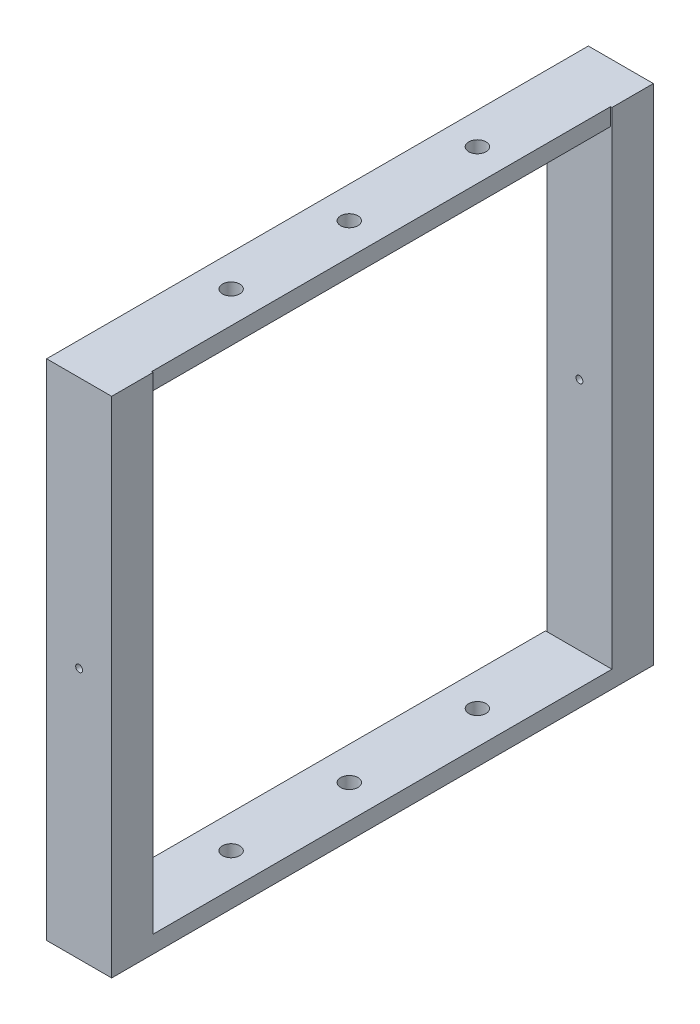
from build123d import *

# Parameters (mm, degrees)
SKETCH1_W            = 133
SKETCH1_H            = 133
BOSS_EXTRUDE2_DEPTH  = 136
SKETCH2_W            = 133
SKETCH2_H            = 118
CUT_EXTRUDE1_DEPTH   = 136
BOSS_EXTRUDE3_DEPTH  = 10.5
SKETCH5_W            = 21
SKETCH5_H            = 3
BOSS_EXTRUDE4_DEPTH  = 23.5
SKETCH6_W            = 42
SKETCH6_H            = 17.2
CUT_EXTRUDE2_DEPTH   = 3
BOSS_EXTRUDE5_DEPTH  = 10.5
SKETCH8_W            = 21
SKETCH8_H            = 3
BOSS_EXTRUDE6_DEPTH  = 23.5
SKETCH9_W            = 42
SKETCH9_H            = 17.2
CUT_EXTRUDE3_DEPTH   = 3
SKETCH10_W           = 19.261488562
SKETCH10_H           = 133
BOSS_EXTRUDE7_DEPTH  = 5
SKETCH11_W           = 18.43727499
SKETCH11_H           = 133
BOSS_EXTRUDE8_DEPTH  = 5
SKETCH12_W           = 18.849381776
SKETCH12_H           = 146
BOSS_EXTRUDE9_DEPTH  = 12
SKETCH14_W           = 18.849381776
SKETCH14_H           = 146
BOSS_EXTRUDE10_DEPTH = 12
SKETCH17_R           = 1
CUT_EXTRUDE4_DEPTH   = 222.251553667
SKETCH18_W           = 133
SKETCH18_H           = 136
CUT_EXTRUDE5_DEPTH   = 170
SKETCH20_R           = 2.5
CUT_EXTRUDE6_DEPTH   = 10
SKETCH22_R           = 2.5
CUT_EXTRUDE8_DEPTH   = 170
SKETCH24_R           = 2.5
CUT_EXTRUDE9_DEPTH   = 170
SKETCH26_R           = 2.474722671
CUT_EXTRUDE10_DEPTH  = 177
SKETCH27_R           = 2.5
CUT_EXTRUDE11_DEPTH  = 177
SKETCH29_R           = 2.5
CUT_EXTRUDE12_DEPTH  = 177
SKETCH30_R           = 2.5
CUT_EXTRUDE13_DEPTH  = 178
SKETCH31_R           = 2.5
CUT_EXTRUDE14_DEPTH  = 178
SKETCH32_R           = 2.474722671
SKETCH32_R_2         = 2.5
BOSS_EXTRUDE11_DEPTH = 5
SKETCH33_R           = 2.5
BOSS_EXTRUDE12_DEPTH = 5


with BuildPart() as part:
    # Sketch1 → Boss-Extrude2 (new body)
    with BuildSketch(Plane(origin=(0, 0, 0), x_dir=(1, 0, 0), z_dir=(0, 1, 0))):
        Rectangle(SKETCH1_W, SKETCH1_H)
    extrude(amount=BOSS_EXTRUDE2_DEPTH)

    # Sketch2 → Cut-Extrude1 (cut)
    with BuildSketch(Plane.XY.offset(66.5)):
        with Locations((0, 68)):
            Rectangle(SKETCH2_W, SKETCH2_H)
    extrude(amount=-CUT_EXTRUDE1_DEPTH, mode=Mode.SUBTRACT)


with BuildPart() as cut_extrude1_piece_1:
    # of the separate pieces the step leaves, piece 1, a body of its own (cut_extrude1_pieces)
    add(part.part.solids().sort_by_distance((-66.5, 0, 66.5))[0])

    # Sketch4 → Boss-Extrude3 (add)
    with BuildSketch(Plane(origin=(0, 9, 0), x_dir=(1, 0, 0), z_dir=(0, 1, 0))):
        Polygon((22.75, -22.75), (43.75, -22.75), (46.25, -22.75), (46.25, -20.25), (20.25, -20.25), (20.25, -46.25), (46.25, -46.25), (46.25, -43.75), (43.75, -43.75), (22.75, -43.75), align=None)
        Polygon((22.75, 43.75), (43.75, 43.75), (46.25, 43.75), (46.25, 46.25), (20.25, 46.25), (20.25, 20.25), (46.25, 20.25), (46.25, 22.75), (43.75, 22.75), (22.75, 22.75), align=None)
    extrude(amount=BOSS_EXTRUDE3_DEPTH)

    # Sketch5 → Boss-Extrude4 (add)
    with BuildSketch(Plane(origin=(22.75, 0, 0), x_dir=(0, 0, -1), z_dir=(1, 0, 0))):
        with Locations((-33.25, 18)):
            Rectangle(SKETCH5_W, SKETCH5_H)
        with Locations((33.25, 18)):
            Rectangle(SKETCH5_W, SKETCH5_H)
    extrude(amount=BOSS_EXTRUDE4_DEPTH)

    # Sketch6 → Cut-Extrude2 (cut)
    with BuildSketch(Plane(origin=(0, 19.5, 0), x_dir=(1, 0, 0), z_dir=(0, 1, 0))):
        with Locations((46.25, -33.25)):
            Rectangle(SKETCH6_W, SKETCH6_H)
        with Locations((46.25, 33.25)):
            Rectangle(SKETCH6_W, SKETCH6_H)
    extrude(amount=-CUT_EXTRUDE2_DEPTH, mode=Mode.SUBTRACT)

    # Sketch10 → Boss-Extrude7 (add)
    with BuildSketch(Plane.XZ):
        Rectangle(SKETCH10_W, SKETCH10_H)
    extrude(amount=BOSS_EXTRUDE7_DEPTH)



with BuildPart() as cut_extrude1_piece_2:
    # of the separate pieces the step leaves, piece 2, a body of its own (cut_extrude1_pieces)
    add(part.part.solids().sort_by_distance((66.5, 127, 66.5))[0])

    # Sketch7 → Boss-Extrude5 (add)
    with BuildSketch(Plane.XZ.offset(-127)):
        Polygon((-43.75, 43.75), (-22.75, 43.75), (-22.75, 22.75), (-43.75, 22.75), (-46.25, 22.75), (-46.25, 20.25), (-20.25, 20.25), (-20.25, 46.25), (-46.25, 46.25), (-46.25, 43.75), align=None)
        Polygon((-43.75, -22.75), (-22.75, -22.75), (-22.75, -43.75), (-43.75, -43.75), (-46.25, -43.75), (-46.25, -46.25), (-20.25, -46.25), (-20.25, -20.25), (-46.25, -20.25), (-46.25, -22.75), align=None)
    extrude(amount=BOSS_EXTRUDE5_DEPTH)

    # Sketch8 → Boss-Extrude6 (add)
    with BuildSketch(Plane.ZY.offset(22.75)):
        with Locations((33.25, 118)):
            Rectangle(SKETCH8_W, SKETCH8_H)
        with Locations((-33.25, 118)):
            Rectangle(SKETCH8_W, SKETCH8_H)
    extrude(amount=BOSS_EXTRUDE6_DEPTH)

    # Sketch9 → Cut-Extrude3 (cut)
    with BuildSketch(Plane.XZ.offset(-116.5)):
        with Locations((-46.25, 33.25)):
            Rectangle(SKETCH9_W, SKETCH9_H)
        with Locations((-46.25, -33.25)):
            Rectangle(SKETCH9_W, SKETCH9_H)
    extrude(amount=-CUT_EXTRUDE3_DEPTH, mode=Mode.SUBTRACT)

    # Sketch11 → Boss-Extrude8 (add)
    with BuildSketch(Plane(origin=(0, 136, 0), x_dir=(1, 0, 0), z_dir=(0, 1, 0))):
        Rectangle(SKETCH11_W, SKETCH11_H)
    extrude(amount=BOSS_EXTRUDE8_DEPTH)


with BuildPart() as cut_extrude1_piece_1_1:
    add(cut_extrude1_piece_1.part)

    add(cut_extrude1_piece_2.part)  # Boss-Extrude9 merges Cut-Extrude1 piece 2
    # Sketch12 → Boss-Extrude9 (add)
    with BuildSketch(Plane(origin=(0, 0, -66.5), x_dir=(-1, 0, 0), z_dir=(0, 0, -1))):
        with Locations((-0.206053393, 68)):
            Rectangle(SKETCH12_W, SKETCH12_H)
    extrude(amount=BOSS_EXTRUDE9_DEPTH)

    # Sketch14 → Boss-Extrude10 (add)
    with BuildSketch(Plane.XY.offset(66.5)):
        with Locations((0.206053393, 68)):
            Rectangle(SKETCH14_W, SKETCH14_H)
    extrude(amount=BOSS_EXTRUDE10_DEPTH)

    # Sketch17 → Cut-Extrude4 (cut, through all)
    with BuildSketch(Plane.XY.offset(78.5)):
        with Locations((0.206053393, 68)):
            Circle(SKETCH17_R)
    extrude(amount=-CUT_EXTRUDE4_DEPTH, mode=Mode.SUBTRACT)

    # Sketch18 → Cut-Extrude5 (cut)
    with BuildSketch(Plane.ZY.offset(66.5)):
        with Locations((0, 68)):
            Rectangle(SKETCH18_W, SKETCH18_H)
    extrude(amount=-CUT_EXTRUDE5_DEPTH, mode=Mode.SUBTRACT)

    # Sketch20 → Cut-Extrude6 (cut)
    with BuildSketch(Plane(origin=(0, 0, 0), x_dir=(1, 0, 0), z_dir=(0, 1, 0))):
        with Locations(Location((0, 0, 0), (0, 0, 270))):
            Circle(SKETCH20_R)
    extrude(amount=-CUT_EXTRUDE6_DEPTH, mode=Mode.SUBTRACT)

    # Sketch22 → Cut-Extrude8 (cut)
    with BuildSketch(Plane(origin=(0, 0, 0), x_dir=(1, 0, 0), z_dir=(0, 1, 0))):
        with Locations(Location((0, 0, 0), (0, 0, 270))):
            Circle(SKETCH22_R)
    extrude(amount=CUT_EXTRUDE8_DEPTH, mode=Mode.SUBTRACT)

    # Sketch24 → Cut-Extrude9 (cut)
    with BuildSketch(Plane(origin=(0, 0, 0), x_dir=(1, 0, 0), z_dir=(0, 1, 0))):
        with Locations(Location((0, 59.159797643, 0), (0, 0, 270))):
            Circle(SKETCH24_R)
    extrude(amount=-CUT_EXTRUDE9_DEPTH, mode=Mode.SUBTRACT)

    # Sketch26 → Cut-Extrude10 (cut)
    with BuildSketch(Plane(origin=(0, 9, 0), x_dir=(1, 0, 0), z_dir=(0, 1, 0))):
        with Locations(Location((0, 59.159797643, 0), (0, 0, 90))):
            Circle(SKETCH26_R)
    extrude(amount=CUT_EXTRUDE10_DEPTH, mode=Mode.SUBTRACT)

    # Sketch27 → Cut-Extrude11 (cut)
    with BuildSketch(Plane(origin=(0, 0, 0), x_dir=(1, 0, 0), z_dir=(0, 1, 0))):
        with Locations(Location((0, -59.499471122, 0), (0, 0, 270))):
            Circle(SKETCH27_R)
    extrude(amount=-CUT_EXTRUDE11_DEPTH, mode=Mode.SUBTRACT)

    # Sketch29 → Cut-Extrude12 (cut)
    with BuildSketch(Plane.XZ.offset(5)):
        with Locations(Location((0, 59.499471122, 0), (0, 0, 90))):
            Circle(SKETCH29_R)
    extrude(amount=-CUT_EXTRUDE12_DEPTH, mode=Mode.SUBTRACT)

    # Sketch30 → Cut-Extrude13 (cut)
    with BuildSketch(Plane(origin=(0, 141, 0), x_dir=(1, 0, 0), z_dir=(0, 1, 0))):
        with Locations(Location((0, 37.126366322, 0), (0, 0, 270))):
            Circle(SKETCH30_R)
    extrude(amount=-CUT_EXTRUDE13_DEPTH, mode=Mode.SUBTRACT)

    # Sketch31 → Cut-Extrude14 (cut)
    with BuildSketch(Plane(origin=(0, 141, 0), x_dir=(1, 0, 0), z_dir=(0, 1, 0))):
        with Locations(Location((0, -34.245307912, 0), (0, 0, 270))):
            Circle(SKETCH31_R)
    extrude(amount=-CUT_EXTRUDE14_DEPTH, mode=Mode.SUBTRACT)

    # Sketch32 → Boss-Extrude11 (add)
    with BuildSketch(Plane(origin=(0, 141, 0), x_dir=(1, 0, 0), z_dir=(0, 1, 0))):
        with Locations((0, 59.159797643)):
            Circle(SKETCH32_R)
        with Locations(Location((0, -59.499471122, 0), (0, 0, 270))):
            Circle(SKETCH32_R_2)
    extrude(amount=-BOSS_EXTRUDE11_DEPTH)

    # Sketch33 → Boss-Extrude12 (add)
    with BuildSketch(Plane.XZ.offset(5)):
        with Locations((0, -59.159797643)):
            Circle(SKETCH33_R)
        with Locations((0, 59.499471122)):
            Circle(SKETCH33_R)
    extrude(amount=-BOSS_EXTRUDE12_DEPTH)


solid = cut_extrude1_piece_1_1.part
